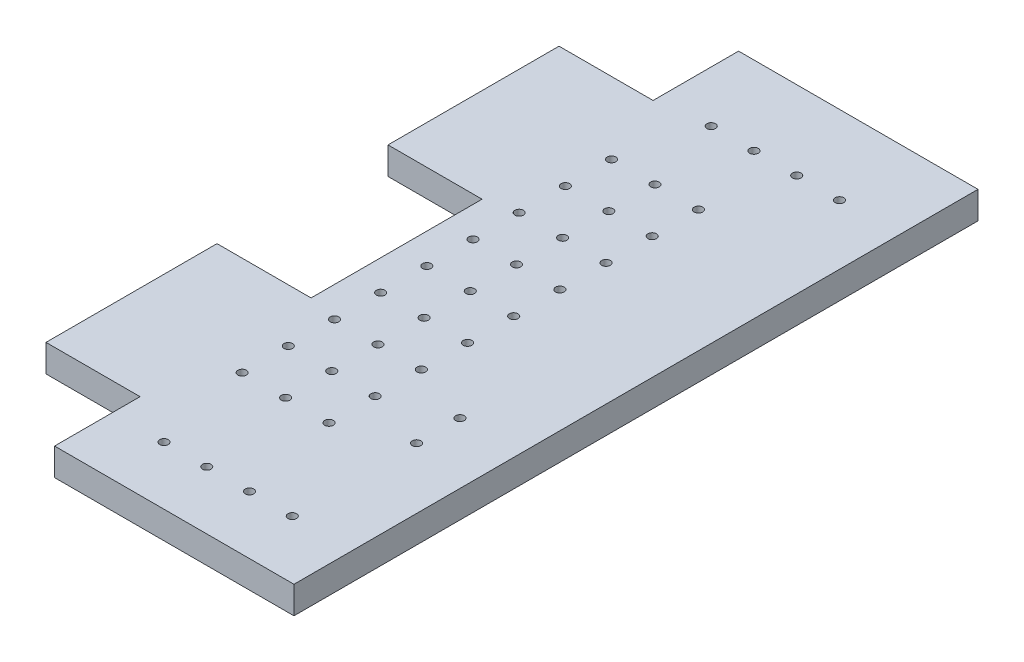
from build123d import *

# Parameters (mm, degrees)
SKETCH_1_W                  = 19.5
SKETCH_1_H                  = 40
EXTRUDE_1_DEPTH             = 1.6
SKETCH_2_W                  = 5.5
SKETCH_2_H                  = 5
SKETCH_2_H_2                = 10
CUT_EXTRUDE_1_DEPTH         = 45.528754755
HOLE_WIZARD_0_5_0_5_1_D     = 0.5
PATTERN_LINEAR_1_COUNT      = 4
PATTERN_LINEAR_1_PITCH      = 2.5
HOLE_WIZARD_0_5_0_5_2_D     = 0.5
PATTERN_LINEAR_2_COUNT      = 3
PATTERN_LINEAR_2_PITCH      = 2.54
PATTERN_LINEAR_2_COUNT_DIR2 = 9
PATTERN_LINEAR_2_PITCH_DIR2 = 2.7
HOLE_WIZARD_0_5_0_5_3_D     = 0.5
PATTERN_LINEAR_3_COUNT      = 2
PATTERN_LINEAR_3_PITCH      = 2.54
HOLE_WIZARD_0_5_0_5_4_D     = 0.5
PATTERN_LINEAR_4_COUNT      = 4
PATTERN_LINEAR_4_PITCH      = 2.5


with BuildPart() as part:
    # 스케치1 → 보스-돌출1 (new body)
    with BuildSketch(Plane(origin=(0, 0, 0), x_dir=(1, 0, 0), z_dir=(0, 1, 0))):
        with Locations((9.75, 20)):
            Rectangle(SKETCH_1_W, SKETCH_1_H)
    extrude(amount=EXTRUDE_1_DEPTH)

    # 스케치2 → 컷-돌출1 (cut, through all)
    with BuildSketch(Plane(origin=(0, 1.6, 0), x_dir=(1, 0, 0), z_dir=(0, 1, 0))):
        with Locations((2.75, 2.5)):
            Rectangle(SKETCH_2_W, SKETCH_2_H)
        with Locations((2.75, 37.5)):
            Rectangle(SKETCH_2_W, SKETCH_2_H)
        with Locations((2.75, 20)):
            Rectangle(SKETCH_2_W, SKETCH_2_H_2)
    extrude(amount=-CUT_EXTRUDE_1_DEPTH, mode=Mode.SUBTRACT)

    # Ø0.5 (0.5) 지름 구멍1 (through all)
    with Locations(Plane(origin=(0, 1.6, 0), x_dir=(1, 0, 0), z_dir=(0, 1, 0))):
        with Locations((8.5, 35.4)):
            hole_wizard_0_5_0_5_1 = Hole(HOLE_WIZARD_0_5_0_5_1_D / 2)

    # 선형 패턴1: Ø0.5 (0.5) 지름 구멍1 ×4
    with Locations(*[(i * PATTERN_LINEAR_1_PITCH, 0, 0) for i in range(1, PATTERN_LINEAR_1_COUNT)]):
        add(hole_wizard_0_5_0_5_1, mode=Mode.SUBTRACT)

    # Ø0.5 (0.5) 지름 구멍2 (through all)
    with Locations(Plane(origin=(0, 1.6, 0), x_dir=(1, 0, 0), z_dir=(0, 1, 0))):
        with Locations((7.27, 30.8)):
            hole_wizard_0_5_0_5_2 = Hole(HOLE_WIZARD_0_5_0_5_2_D / 2)

    # 선형 패턴2: Hole Wizard 0.5 _0.5_ _ _2 3 × 9
    with Locations(*[(i * PATTERN_LINEAR_2_PITCH, 0, j * PATTERN_LINEAR_2_PITCH_DIR2) for i in range(PATTERN_LINEAR_2_COUNT) for j in range(PATTERN_LINEAR_2_COUNT_DIR2) if (i, j) != (0, 0)]):
        add(hole_wizard_0_5_0_5_2, mode=Mode.SUBTRACT)

    # Ø0.5 (0.5) 지름 구멍3 (through all)
    with Locations(Plane(origin=(0, 1.6, 0), x_dir=(1, 0, 0), z_dir=(0, 1, 0))):
        with Locations((15.941577117, 10.725654996)):
            hole_wizard_0_5_0_5_3 = Hole(HOLE_WIZARD_0_5_0_5_3_D / 2)

    # 선형 패턴3: Ø0.5 (0.5) 지름 구멍3 ×2
    with Locations(*[(0, 0, -i * PATTERN_LINEAR_3_PITCH) for i in range(1, PATTERN_LINEAR_3_COUNT)]):
        add(hole_wizard_0_5_0_5_3, mode=Mode.SUBTRACT)

    # Ø0.5 (0.5) 지름 구멍4 (through all)
    with Locations(Plane(origin=(0, 1.6, 0), x_dir=(1, 0, 0), z_dir=(0, 1, 0))):
        with Locations((8.5, 3.4)):
            hole_wizard_0_5_0_5_4 = Hole(HOLE_WIZARD_0_5_0_5_4_D / 2)

    # 선형 패턴4: Ø0.5 (0.5) 지름 구멍4 ×4
    with Locations(*[(i * PATTERN_LINEAR_4_PITCH, 0, 0) for i in range(1, PATTERN_LINEAR_4_COUNT)]):
        add(hole_wizard_0_5_0_5_4, mode=Mode.SUBTRACT)


solid = part.part
